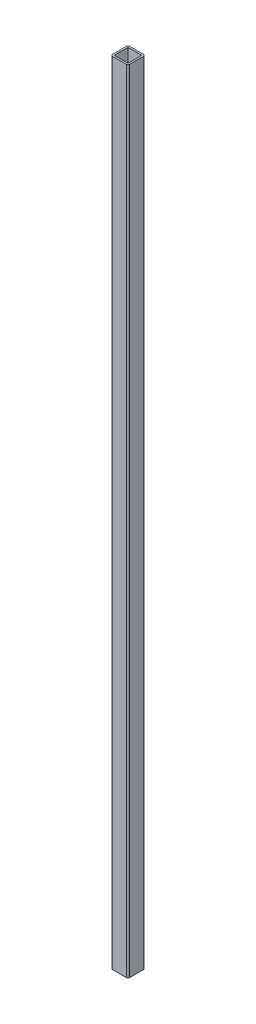
from build123d import *

# Parameters (mm, degrees)
SKETCH4_W           = 25.4
SKETCH4_H           = 25.4
BOSS_EXTRUDE6_DEPTH = 1168.4
SHELL1_T            = -2.54
FILLET1_R           = 2.54


with BuildPart() as part:
    # Sketch4 → Boss-Extrude6 (new body)
    with BuildSketch(Plane(origin=(0, 0, 0), x_dir=(1, 0, 0), z_dir=(0, 1, 0))):
        Rectangle(SKETCH4_W, SKETCH4_H)
    extrude(amount=BOSS_EXTRUDE6_DEPTH)

    # Shell1
    shell1_openings = [part.faces().sort_by_distance(p)[0] for p in [
        (0, 1168.4, 0),
        (0, 0, 0),
    ]]
    offset(amount=SHELL1_T, openings=shell1_openings, kind=Kind.INTERSECTION)

    # Fillet1
    fillet1_edges = [part.edges().sort_by_distance(p)[0] for p in [
        (12.7, 584.2, -12.7),
        (12.7, 584.2, 12.7),
        (-12.7, 584.2, 12.7),
        (-12.7, 584.2, -12.7),
    ]]
    fillet(fillet1_edges, radius=FILLET1_R)


solid = part.part
